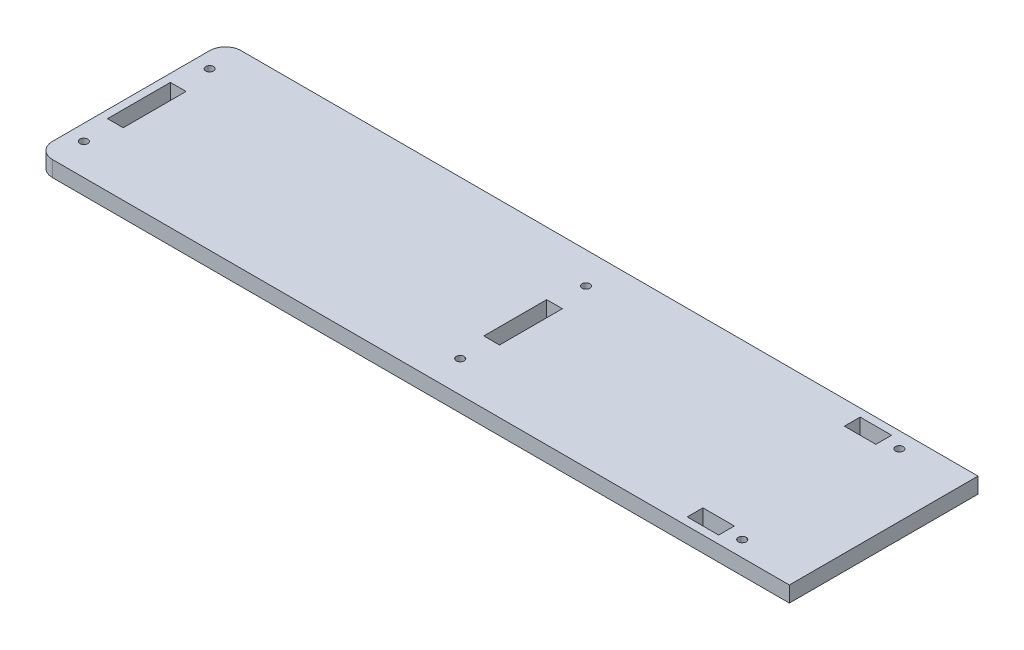
from build123d import *

# Parameters (mm, degrees)
SKETCH1_R           = 1.5875
BOSS_EXTRUDE1_DEPTH = 6.35


with BuildPart() as part:
    # Sketch1 → Boss-Extrude1 (new body)
    with BuildSketch(Plane(origin=(0, 0, 0), x_dir=(1, 0, 0), z_dir=(0, 1, 0))):
        with BuildLine():
            Line((-51.235076938, -113.333409223), (246.459341535, -113.333409223))
            Line((246.459341535, -113.333409223), (246.459341535, -37.133409223))
            Line((246.459341535, -37.133409223), (-51.235076938, -37.133409223))
            ThreePointArc((-51.235076938, -37.133409223), (-55.725204999, -38.993281163), (-57.585076938, -43.483409223))
            Line((-57.585076938, -43.483409223), (-57.585076938, -106.983409223))
            ThreePointArc((-57.585076938, -106.983409223), (-55.725204999, -111.473537284), (-51.235076938, -113.333409223))
        make_face()
        with Locations(Location((-51.235076938, -100.633409223, 0), (0, 0, 270))):
            Circle(SKETCH1_R, mode=Mode.SUBTRACT)
        with Locations(Location((-51.235076938, -49.833409223, 0), (0, 0, 270))):
            Circle(SKETCH1_R, mode=Mode.SUBTRACT)
        with Locations(Location((100.787132298, -100.633409223, 0), (0, 0, 270))):
            Circle(SKETCH1_R, mode=Mode.SUBTRACT)
        with Locations(Location((100.787132298, -49.833409223, 0), (0, 0, 270))):
            Circle(SKETCH1_R, mode=Mode.SUBTRACT)
        with Locations(Location((221.059341535, -106.983409223, 0), (0, 0, 270))):
            Circle(SKETCH1_R, mode=Mode.SUBTRACT)
        with Locations(Location((221.059341535, -43.483409223, 0), (0, 0, 270))):
            Circle(SKETCH1_R, mode=Mode.SUBTRACT)
        Polygon((-54.410076938, -75.233409223), (-54.410076938, -62.533409223), (-48.060076938, -62.533409223), (-48.060076938, -87.933409223), (-54.410076938, -87.933409223), align=None, mode=Mode.SUBTRACT)
        Polygon((97.612132298, -75.233409223), (97.612132298, -62.533409223), (103.962132298, -62.533409223), (103.962132298, -87.933409223), (97.612132298, -87.933409223), align=None, mode=Mode.SUBTRACT)
        Polygon((208.359341535, -103.808409223), (202.009341535, -103.808409223), (202.009341535, -110.158409223), (214.709341535, -110.158409223), (214.709341535, -103.808409223), align=None, mode=Mode.SUBTRACT)
        Polygon((208.359341535, -46.658409223), (202.009341535, -46.658409223), (202.009341535, -40.308409223), (214.709341535, -40.308409223), (214.709341535, -46.658409223), align=None, mode=Mode.SUBTRACT)
    extrude(amount=BOSS_EXTRUDE1_DEPTH)


solid = part.part
